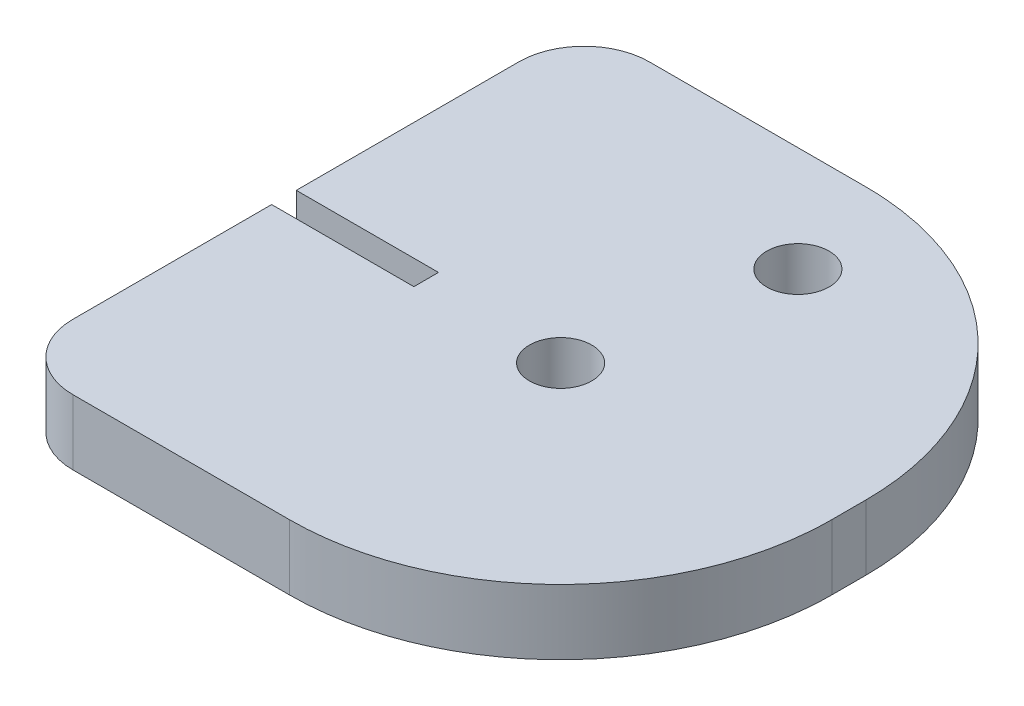
from build123d import *

# Parameters (mm, degrees)
SKETCH1_W           = 50.8
SKETCH1_H           = 21.59
BOSS_EXTRUDE1_DEPTH = 3.175
FILLET1_R           = 10.16
SKETCH3_R           = 1.16713
CUT_EXTRUDE1_DEPTH  = 28.780796425
FILLET3_R           = 10.16
SCALE1_SCALE_X      = 1.3
SCALE1_SCALE_Y      = 1
SCALE1_SCALE_Z      = 1.3
SKETCH4_W           = 39.116
SKETCH4_H           = 28.067
CUT_EXTRUDE2_DEPTH  = 37.054605389
FILLET4_R           = 3.175
SKETCH7_W           = 6.925112
SKETCH7_H           = 1.2
CUT_EXTRUDE3_DEPTH  = 37.054605389


with BuildPart() as part:
    # Sketch1 → Boss-Extrude1 (new body)
    with BuildSketch(Plane(origin=(0, 0, 0), x_dir=(1, 0, 0), z_dir=(0, 1, 0))):
        Rectangle(SKETCH1_W, SKETCH1_H)
    extrude(amount=BOSS_EXTRUDE1_DEPTH)

    # Fillet1
    fillet1_edges = [part.edges().sort_by_distance(p)[0] for p in [
        (25.4, 1.5875, 10.795),
        (-25.4, 1.5875, 10.795),
    ]]
    fillet(fillet1_edges, radius=FILLET1_R)

    # Sketch3 → Cut-Extrude1 (cut, through all)
    with BuildSketch(Plane(origin=(0, 3.175, 0), x_dir=(1, 0, 0), z_dir=(0, 1, 0))):
        with Locations(Location((15.24, -0.635, 0), (0, 0, 270))):
            Circle(SKETCH3_R)
        with Locations(Location((16.637, 6.855847148, 0), (0, 0, 270))):
            Circle(SKETCH3_R)
        with Locations(Location((-3.81, -0.635, 0), (0, 0, 270))):
            Circle(SKETCH3_R)
    extrude(amount=-CUT_EXTRUDE1_DEPTH, mode=Mode.SUBTRACT)

    # Fillet3
    fillet3_edges = [part.edges().sort_by_distance(p)[0] for p in [
        (-25.4, 1.5875, -10.795),
        (25.4, 1.5875, -10.795),
    ]]
    fillet(fillet3_edges, radius=FILLET3_R)


with BuildPart() as part_1:
    # Scale1: scaled about (-0.120675705, 1.5875, 0.024016676)
    add(part.part.scale((SCALE1_SCALE_X, SCALE1_SCALE_Y, SCALE1_SCALE_Z), about=(-0.120675705, 1.5875, 0.024016676)))

    # Sketch4 → Cut-Extrude2 (cut, through all)
    with BuildSketch(Plane(origin=(0, 3.175, 0), x_dir=(1, 0, 0), z_dir=(0, 1, 0))):
        with Locations((-13.425797288, 0.007205003)):
            Rectangle(SKETCH4_W, SKETCH4_H)
    extrude(amount=-CUT_EXTRUDE2_DEPTH, mode=Mode.SUBTRACT)

    # Fillet4
    fillet4_edges = [part_1.edges().sort_by_distance(p)[0] for p in [
        (6.132202712, 1.5875, -14.040705003),
        (6.132202712, 1.5875, 14.026294997),
    ]]
    fillet(fillet4_edges, radius=FILLET4_R)

    # Sketch7 → Cut-Extrude3 (cut, through all)
    with BuildSketch(Plane.XZ):
        with Locations((9.594758712, 0.571779506)):
            Rectangle(SKETCH7_W, SKETCH7_H)
    extrude(amount=-CUT_EXTRUDE3_DEPTH, mode=Mode.SUBTRACT)


solid = part_1.part
